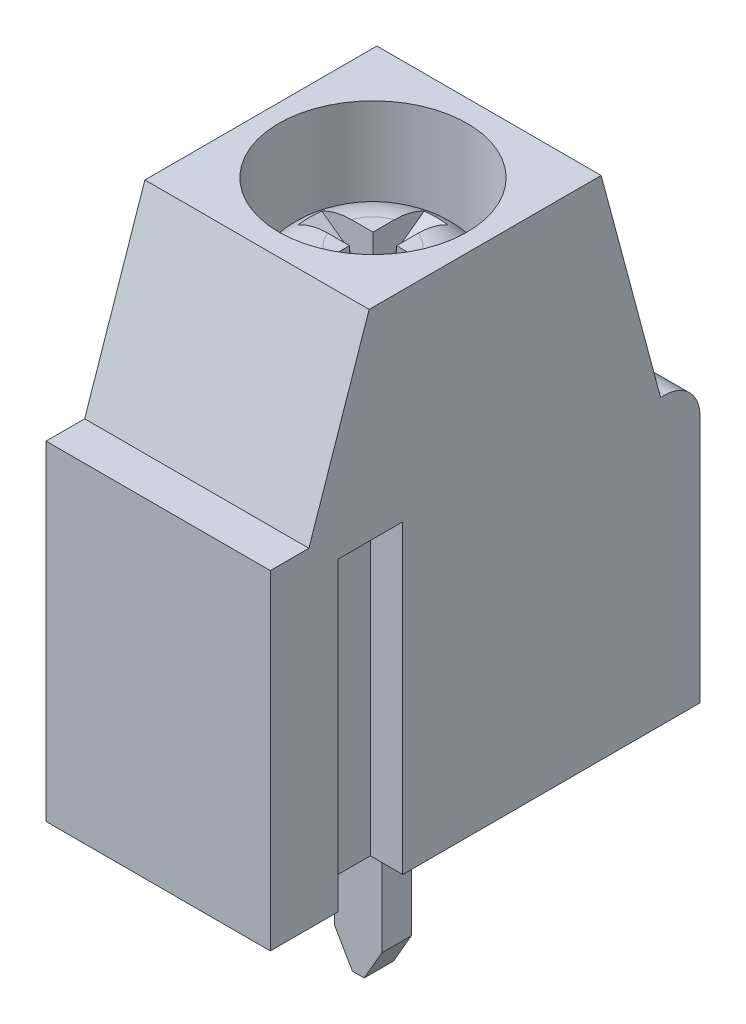
from build123d import *

# Parameters (mm, degrees)
BOSS_EXTRUDE1_DEPTH      = 3.81
CUT_EXTRUDE_1_DEPTH      = 3.01
SKETCH_4_R               = 1.6
CUT_EXTRUDE_2_DEPTH      = 4
SKETCH_7_W               = 1
SKETCH_7_H               = 5.139654773
EXTRUDE_1_DEPTH          = 0.5
SKETCH_8_W               = 1.1
SKETCH_8_H               = 5.189654773
CUT_EXTRUDE_4_DEPTH      = 0.55
SKETCH_10_W              = 0.8
SKETCH_10_H              = 0.5
EXTRUDE_2_DEPTH          = 3
CHAMFER_2_SIZE           = 0.3
CHAMFER_2_SIZE2          = 0.519615242
CHAMFER_3_SIZE           = 0.3
CHAMFER_3_SIZE2          = 0.519615242
CUT_EXTRUDE_START        = 0.2
CUT_EXTRUDE_5_DEPTH      = 0.4
PATTERN_CIRCULAR_1_COUNT = 4


with BuildPart() as part:
    # Sketch1 → Boss-Extrude1 (new body)
    with BuildSketch(Plane(origin=(0, 0, 0), x_dir=(0, 0, -1), z_dir=(1, 0, 0))):
        with BuildLine():
            Line((5.620897226, 8.6), (6.631206986, 4.827492088))
            Line((6.631206986, 4.827492088), (6.7, 4.827492088))
            ThreePointArc((6.7, 4.827492088), (7.124264069, 4.651756157), (7.3, 4.227492088))
            Line((7.3, 4.227492088), (7.3, 0))
            Line((7.3, 0), (0, 0))
            Line((0, 0), (0, 5.59717585))
            Line((0, 5.59717585), (0.656126643, 5.59717585))
            Line((0.656126643, 5.59717585), (1.679102774, 8.6))
            Line((1.679102774, 8.6), (5.620897226, 8.6))
        make_face()
    extrude(amount=BOSS_EXTRUDE1_DEPTH)

    # Эскиз2 → Вырез-Вытянуть1 (cut)
    with BuildSketch(Plane.ZY.offset(-0.4)):
        Polygon((-7.3, 4.073586509), (-6.032317297, 3.426147995), (-2.931105615, 3.426147995), (-2.931105615, 0.803691629), (-6.262387876, 0.803691629), (-7.3, 0.36356395), align=None)
    extrude(amount=-CUT_EXTRUDE_1_DEPTH, mode=Mode.SUBTRACT)

    # Эскиз4 → Вырез-Вытянуть2 (cut)
    with BuildSketch(Plane(origin=(0, 8.6, 0), x_dir=(1, 0, 0), z_dir=(0, 1, 0))):
        with Locations((1.905, 3.65)):
            Circle(SKETCH_4_R)
    extrude(amount=-CUT_EXTRUDE_2_DEPTH, mode=Mode.SUBTRACT)

    # Эскиз5 → Повернуть1 (revolve)
    with BuildSketch(Plane.ZY.offset(-1.905)):
        with BuildLine():
            Line((-3.65, 7.6), (-4.25, 7.6))
            ThreePointArc((-4.25, 7.6), (-4.957106781, 7.307106781), (-5.25, 6.6))
            Line((-5.25, 6.6), (-5.25, 5.694446069))
            Line((-5.25, 5.694446069), (-3.65, 5.694446069))
            Line((-3.65, 5.694446069), (-3.65, 7.6))
        make_face()
    revolve(axis=Axis((1.905, 7.6, -3.65), (0, -1, 0)))

    # Эскиз7 → Бобышка-Вытянуть1 (add)
    with BuildSketch(Plane.ZY):
        with Locations((-1.7, 2.569827387)):
            Rectangle(SKETCH_7_W, SKETCH_7_H)
    extrude(amount=EXTRUDE_1_DEPTH)

    # Эскиз8 → Вырез-Вытянуть4 (cut)
    with BuildSketch(Plane(origin=(3.81, 0, 0), x_dir=(0, 0, -1), z_dir=(1, 0, 0))):
        with Locations((1.7, 2.594827386)):
            Rectangle(SKETCH_8_W, SKETCH_8_H)
    extrude(amount=-CUT_EXTRUDE_4_DEPTH, mode=Mode.SUBTRACT)

    # Эскиз10 → Бобышка-Вытянуть2 (add)
    with BuildSketch(Plane(origin=(0, 0, 0), x_dir=(-1, 0, 0), z_dir=(0, -1, 0))):
        with Locations((-1.905, 3.65)):
            Rectangle(SKETCH_10_W, SKETCH_10_H)
    extrude(amount=EXTRUDE_2_DEPTH)

    # Фаска2
    chamfer_2_edges = [part.edges().sort_by_distance(p)[0] for p in [
        (1.505, -3, -3.65),
    ]]
    chamfer_2_side = [part.faces().sort_by_distance(p)[0] for p in [
        (1.905, -3, -3.65),
    ]]
    chamfer(chamfer_2_edges, length=CHAMFER_2_SIZE, length2=CHAMFER_2_SIZE2, reference=chamfer_2_side[0])

    # Фаска3
    chamfer_3_edges = [part.edges().sort_by_distance(p)[0] for p in [
        (2.305, -3, -3.65),
    ]]
    chamfer_3_side = [part.faces().sort_by_distance(p)[0] for p in [
        (2.055, -3, -3.65),
    ]]
    chamfer(chamfer_3_edges, length=CHAMFER_3_SIZE, length2=CHAMFER_3_SIZE2, reference=chamfer_3_side[0])

    # Эскиз11 → Вырез-Вытянуть5 (cut)
    with BuildSketch(Plane.ZY.offset(-1.905).offset(CUT_EXTRUDE_START)):
        Polygon((-4.909756217, 7.996241993), (-3.65, 7.996241993), (-3.65, 6.851621262), (-3.85, 6.851621262), (-4.909756217, 7.607858699), align=None)
    cut_extrude_5 = extrude(amount=-CUT_EXTRUDE_5_DEPTH, mode=Mode.SUBTRACT)

    # Круговой массив1: Вырез-Вытянуть5 ×4 about axis
    pattern_circular_1_axis = Axis((1.905, 6.6, -3.65), (0, 1, 0))
    for i in range(1, PATTERN_CIRCULAR_1_COUNT):
        add(cut_extrude_5.rotate(pattern_circular_1_axis, i * 360 / PATTERN_CIRCULAR_1_COUNT), mode=Mode.SUBTRACT)


solid = part.part
